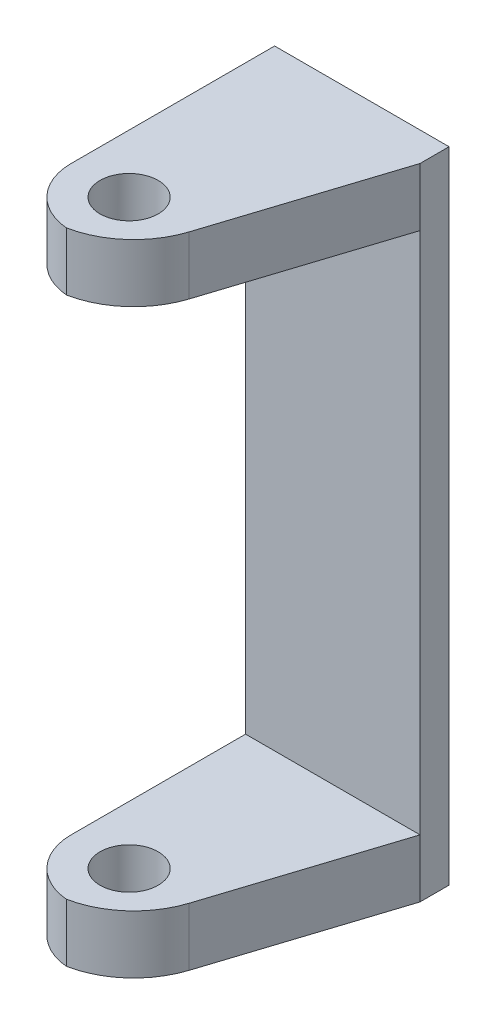
from build123d import *

# Parameters (mm, degrees)
SKETCH1_W               = 30
SKETCH1_H               = 110
BOSS_EXTRUDE1_DEPTH     = 5
SKETCH3_R               = 5
BOSS_EXTRUDE3_DEPTH     = 110
CUT_EXTRUDE3_DEPTH      = 123.576506721
CUT_EXTRUDE3_DEPTH_BACK = 123.576506721
SKETCH5_W               = 40
SKETCH5_H               = 90


with BuildPart() as part:
    # Sketch1 → Boss-Extrude1 (new body)
    with BuildSketch(Plane.XY):
        with Locations((15, 55)):
            Rectangle(SKETCH1_W, SKETCH1_H)
    extrude(amount=BOSS_EXTRUDE1_DEPTH)

    # Sketch3 → Boss-Extrude3 (add, through all)
    with BuildSketch(Plane(origin=(0, 110, 0), x_dir=(1, 0, 0), z_dir=(0, 1, 0))):
        with BuildLine():
            Line((0, -5), (0, -35.031831765))
            ThreePointArc((0, -35.031831765), (2.65246331, -41.815171989), (9.202740917, -45))
            ThreePointArc((9.202740917, -45), (16.121762832, -41.525252064), (20.338661017, -35.031831765))
            Line((20.338661017, -35.031831765), (30, -5))
            Line((30, -5), (0, -5))
        make_face()
        with Locations(Location((10, -35.031831765, 0), (0, 0, 270))):
            Circle(SKETCH3_R, mode=Mode.SUBTRACT)
    extrude(amount=-BOSS_EXTRUDE3_DEPTH)

    # Sketch5 → Cut-Extrude3 (cut, two sides: drawn at the far end of the back side and taken through both)
    with BuildSketch(Plane(origin=(0, 0, 0), x_dir=(0, 0, -1), z_dir=(1, 0, 0)).offset(-CUT_EXTRUDE3_DEPTH_BACK)):
        with Locations((-25, 55)):
            Rectangle(SKETCH5_W, SKETCH5_H)
    extrude(amount=CUT_EXTRUDE3_DEPTH + CUT_EXTRUDE3_DEPTH_BACK, mode=Mode.SUBTRACT)


solid = part.part
